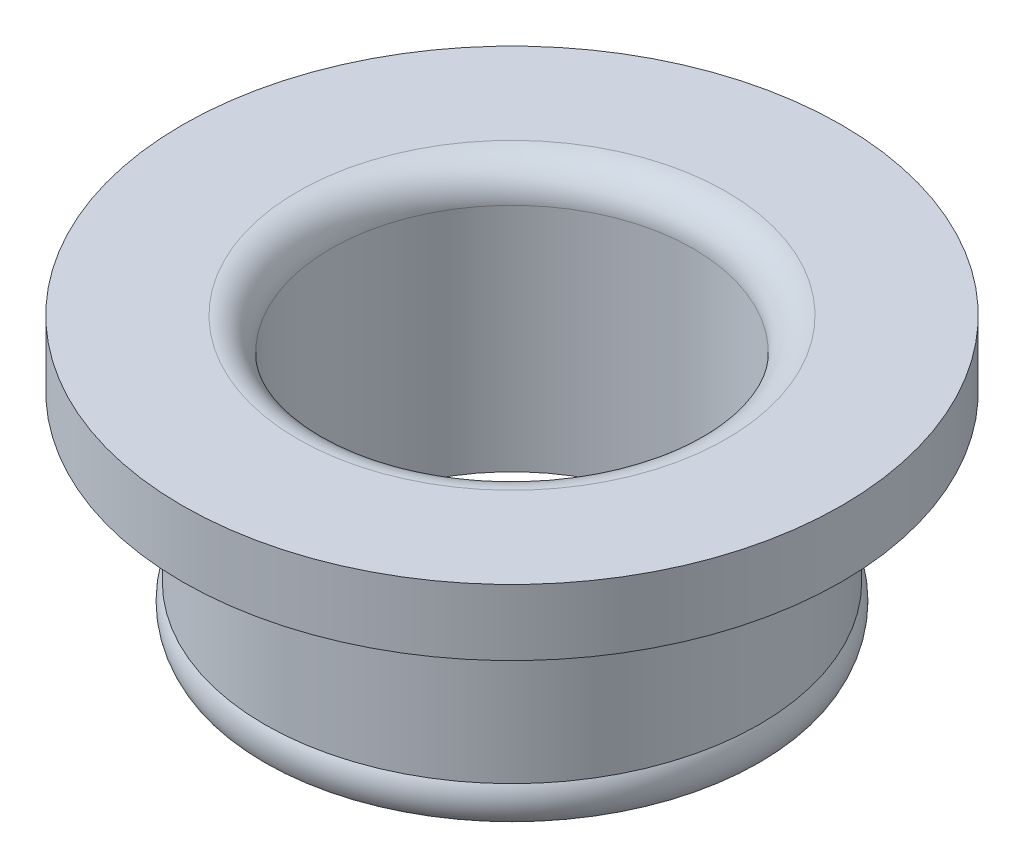
from build123d import *

# Parameters (mm, degrees)
SKETCH1_R           = 12.7
SKETCH1_R_2         = 6.985
BOSS_EXTRUDE1_DEPTH = 2.54
BOSS_EXTRUDE2_START = -7.62
SKETCH1_3_R         = 9.525
SKETCH1_3_R_2       = 6.985
BOSS_EXTRUDE2_DEPTH = 7.62
FILLET1_R           = 1.27
FILLET2_R           = 0.762


with BuildPart() as part:
    # Sketch1 → Boss-Extrude1 (new body)
    with BuildSketch(Plane(origin=(0, 0, 0), x_dir=(1, 0, 0), z_dir=(0, 1, 0))):
        Circle(SKETCH1_R)
        Circle(SKETCH1_R_2, mode=Mode.SUBTRACT)
    extrude(amount=BOSS_EXTRUDE1_DEPTH)

    # Sketch1<3> → Boss-Extrude2 (add)
    with BuildSketch(Plane(origin=(0, 0, 0), x_dir=(1, 0, 0), z_dir=(0, 1, 0)).offset(BOSS_EXTRUDE2_START)):
        Circle(SKETCH1_3_R)
        Circle(SKETCH1_3_R_2, mode=Mode.SUBTRACT)
    extrude(amount=BOSS_EXTRUDE2_DEPTH)

    # Fillet1
    fillet1_edges = [part.edges().sort_by_distance(p)[0] for p in [
        (-6.985, 2.54, 0),
    ]]
    fillet(fillet1_edges, radius=FILLET1_R)

    # Fillet2
    fillet2_edges = [part.edges().sort_by_distance(p)[0] for p in [
        (-9.525, 0, 0),
    ]]
    fillet(fillet2_edges, radius=FILLET2_R)

    # Sketch2 → Revolve1 (revolve)
    with BuildSketch(Plane(origin=(0, 0, 0), x_dir=(0, 0, -1), z_dir=(1, 0, 0))):
        with BuildLine():
            Line((9.525, -6.35), (9.525, -7.62))
            ThreePointArc((9.525, -7.62), (9.695147737, -6.985), (9.525, -6.35))
        make_face()
    revolve(axis=Axis((0, 3.048, 0), (0, -1, 0)))


solid = part.part
